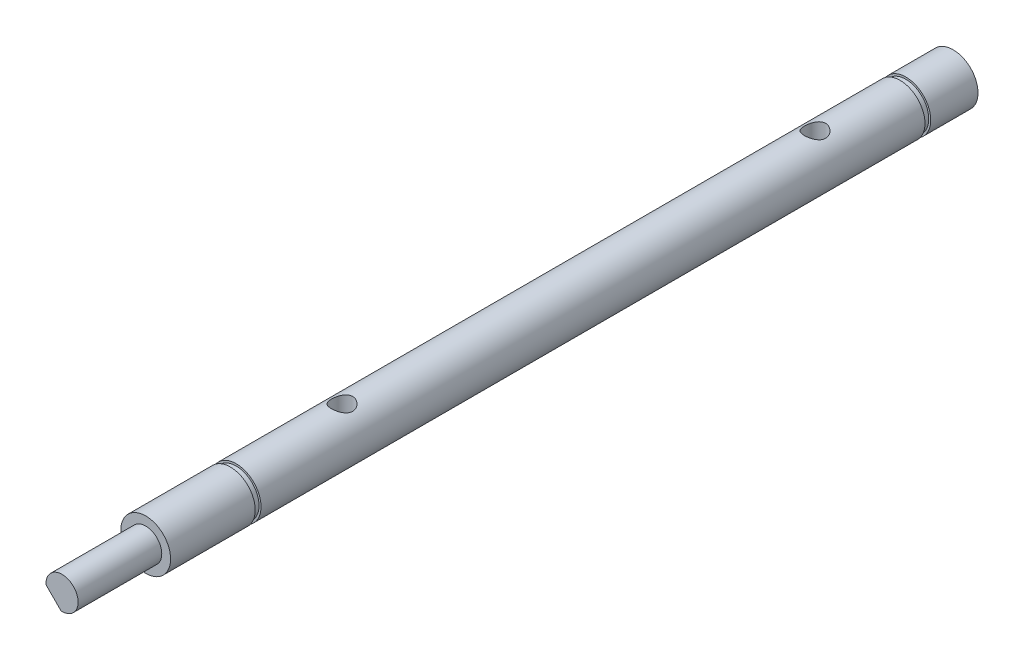
from build123d import *

# Parameters (mm, degrees)
SKETCH1_W                 = 3.175
SKETCH1_H                 = 9.525
SKETCH1_H_2               = 50.8
F_6_32_TAPPED_HOLE1_D     = 2.7051
F_6_32_TAPPED_HOLE1_DEPTH = 9.398
F_6_32_TAPPED_HOLE1_TIP   = 0.81269403
CUT_EXTRUDE1_DEPTH        = 6.35


with BuildPart() as part:
    # Sketch1 → Revolve1 (revolve)
    with BuildSketch(Plane(origin=(0, 0, 0), x_dir=(1, 0, 0), z_dir=(0, 1, 0)), mode=Mode.PRIVATE) as revolve1_sk:
        Polygon((-38.708137827, 86.94610411), (-35.533137827, 86.94610411), (-35.533137827, 99.795553682), (-38.708137827, 99.795553682), (-38.708137827, 93.769403682), (-38.454137827, 93.769403682), (-38.454137827, 93.032803682), (-38.708137827, 93.032803682), align=None)
        with Locations((-37.120637827, 82.18360411)):
            Rectangle(SKETCH1_W, SKETCH1_H)
        with Locations((-37.120637827, 52.02110411)):
            Rectangle(SKETCH1_W, SKETCH1_H_2)
        with Locations((-37.120637827, 21.85860411)):
            Rectangle(SKETCH1_W, SKETCH1_H)
        Polygon((-38.708137827, -3.175), (-37.583137827, -3.175), (-37.583137827, -13.843), (-35.533137827, -13.843), (-35.533137827, 17.09610411), (-38.708137827, 17.09610411), (-38.708137827, 8.3566), (-38.454137827, 8.3566), (-38.454137827, 7.62), (-38.708137827, 7.62), align=None)
    revolve(revolve1_sk.sketch.rotate(Axis((-35.533137827, 0, 13.843), (0, 0, -1)), 180), axis=Axis((-35.533137827, 0, 13.843), (0, 0, -1)))

    # #6-32 Tapped Hole1
    with Locations(Plane(origin=(0, -3.175, 0), x_dir=(-1, 0, 0), z_dir=(0, -1, 0))):
        with Locations((35.533137827, 82.18360411), (35.533137827, 21.85860411)):
            Hole(F_6_32_TAPPED_HOLE1_D / 2, depth=F_6_32_TAPPED_HOLE1_DEPTH)
            with Locations((0, 0, -(F_6_32_TAPPED_HOLE1_DEPTH + F_6_32_TAPPED_HOLE1_TIP / 2))):  # 118° drill point
                Cone(0, F_6_32_TAPPED_HOLE1_D / 2, F_6_32_TAPPED_HOLE1_TIP, mode=Mode.SUBTRACT)

    # Sketch4 → Cut-Extrude1 (cut)
    with BuildSketch(Plane.XY.offset(13.843)):
        Polygon((-19.85306803, -17.854423149), (-35.661514798, -2.045976381), (-37.579114208, -0.128376971), (-53.387560976, 15.680069797), (-85.00445451, -15.936823738), (-51.469961565, -49.471316683), align=None)
    extrude(amount=-CUT_EXTRUDE1_DEPTH, mode=Mode.SUBTRACT)


solid = part.part
